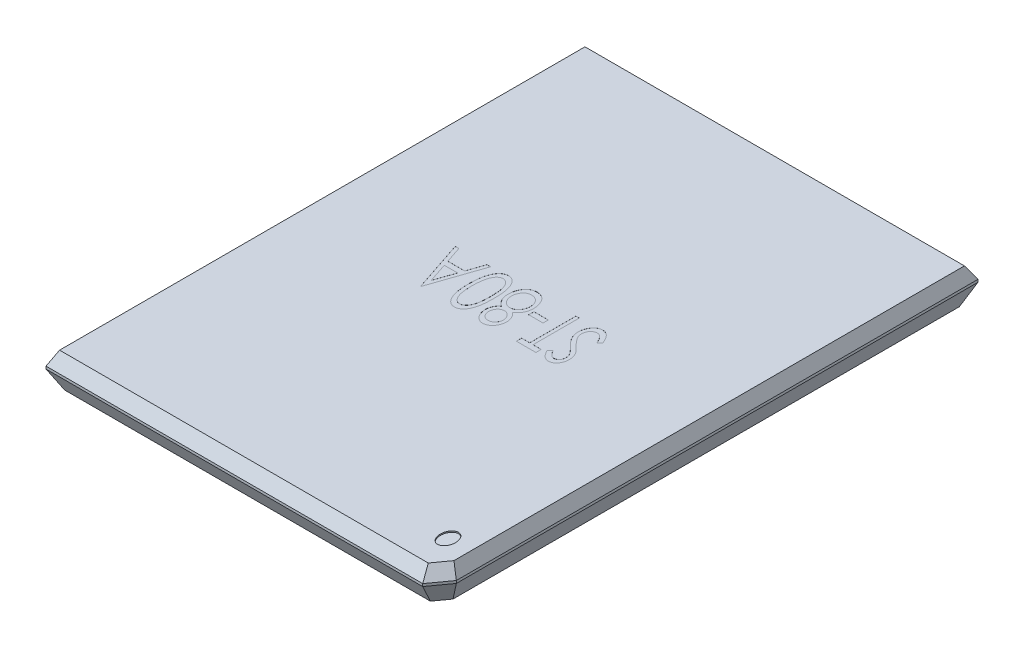
from build123d import *
from OCP.BRepFilletAPI import BRepFilletAPI_MakeChamfer

# Parameters (mm, degrees)
EXTRUDE1_DEPTH     = 1.397
CHAMFER1_SIZE      = 0.508
CHAMFER1_SIZE2     = 0.174918428
SKETCH2_R          = 0.231604239
CUT_EXTRUDE1_DEPTH = 0.0508
SKETCH3_W          = 0.439615384
SKETCH3_H          = 0.11723077
CUT_EXTRUDE2_DEPTH = 0.00254
CHAMFER2_SIZE      = 0.7874
CHAMFER2_SIZE2     = 0.240732339
SCALE1_SCALE_X     = 1.3
SCALE1_SCALE_Y     = 1
SCALE1_SCALE_Z     = 1.8


with BuildPart() as part:
    # Sketch1 → Extrude1 (new body)
    with BuildSketch(Plane(origin=(0, 0, 0), x_dir=(1, 0, 0), z_dir=(0, 1, 0))):
        Polygon((6.00075, -5.567758795), (5.567758795, -6.00075), (5.20854855, -6.00075), (-6.00075, -6.00075), (-6.00075, 6.00075), (6.00075, 6.00075), (6.00075, -5.20854855), align=None)
    extrude(amount=EXTRUDE1_DEPTH)

    # Chamfer1: one chamfer whose edges measure the first distance from different faces: ONE call of the kernel's chamfer builder (chamfer() names one face for all edges)
    chamfer1_edges_1 = [part.edges().sort_by_distance(p)[0] for p in [
        (-6.00075, 1.397, 0),
    ]]
    chamfer1_side_1 = [part.faces().sort_by_distance(p)[0] for p in [
        (-6.00075, 0.6985, 0),
    ]]
    chamfer1_edges_2 = [part.edges().sort_by_distance(p)[0] for p in [
        (-0.216495602, 1.397, 6.00075),
    ]]
    chamfer1_side_2 = [part.faces().sort_by_distance(p)[0] for p in [
        (-0.216495602, 0.6985, 6.00075),
    ]]
    chamfer1_edges_3 = [part.edges().sort_by_distance(p)[0] for p in [
        (5.784254398, 1.397, 5.784254398),
    ]]
    chamfer1_side_3 = [part.faces().sort_by_distance(p)[0] for p in [
        (5.784254398, 0.6985, 5.784254398),
    ]]
    chamfer1_edges_4 = [part.edges().sort_by_distance(p)[0] for p in [
        (6.00075, 1.397, -0.216495602),
    ]]
    chamfer1_side_4 = [part.faces().sort_by_distance(p)[0] for p in [
        (6.00075, 0.6985, -0.216495602),
    ]]
    chamfer1_edges_5 = [part.edges().sort_by_distance(p)[0] for p in [
        (0, 1.397, -6.00075),
    ]]
    chamfer1_side_5 = [part.faces().sort_by_distance(p)[0] for p in [
        (0, 0.6985, -6.00075),
    ]]
    chamfer1 = BRepFilletAPI_MakeChamfer(part.part.solid().wrapped)
    for e in chamfer1_edges_1:
        chamfer1.Add(CHAMFER1_SIZE, CHAMFER1_SIZE2, e.wrapped, chamfer1_side_1[0].wrapped)  # the first distance lies on this face
    for e in chamfer1_edges_2:
        chamfer1.Add(CHAMFER1_SIZE, CHAMFER1_SIZE2, e.wrapped, chamfer1_side_2[0].wrapped)  # the first distance lies on this face
    for e in chamfer1_edges_3:
        chamfer1.Add(CHAMFER1_SIZE, CHAMFER1_SIZE2, e.wrapped, chamfer1_side_3[0].wrapped)  # the first distance lies on this face
    for e in chamfer1_edges_4:
        chamfer1.Add(CHAMFER1_SIZE, CHAMFER1_SIZE2, e.wrapped, chamfer1_side_4[0].wrapped)  # the first distance lies on this face
    for e in chamfer1_edges_5:
        chamfer1.Add(CHAMFER1_SIZE, CHAMFER1_SIZE2, e.wrapped, chamfer1_side_5[0].wrapped)  # the first distance lies on this face
    add(Compound.cast(chamfer1.Shape()), mode=Mode.REPLACE)

    # Sketch2 → Cut-Extrude1 (cut)
    with BuildSketch(Plane(origin=(0, 1.397, 0), x_dir=(-1, 0, 0), z_dir=(0, 1, 0))):
        with Locations(Location((-5.141267289, 5.13311948, 0), (0, 0, 90))):
            Circle(SKETCH2_R)
    extrude(amount=-CUT_EXTRUDE1_DEPTH, mode=Mode.SUBTRACT)

    # Sketch3 → Cut-Extrude2 (cut)
    # profile 1 of 6: a face of its own
    with BuildSketch(Plane(origin=(0, 1.397, 0), x_dir=(-1, 0, 0), z_dir=(0, 1, 0))):
        with BuildLine():
            Line((-2.325409022, -0.3335564), (-2.228785223, -0.275627915))
            add(Edge.make_bspline(
                [(-2.228785223, -0.275627915), (-2.219798553, -0.290671227), (-2.20258044, -0.319493632), (-2.173858039, -0.3584399), (-2.144096634, -0.391541885), (-2.113075832, -0.418607017), (-2.080984981, -0.439915439), (-2.047614589, -0.455003768), (-2.013077109, -0.464414242), (-1.989572516, -0.46555727), (-1.977838108, -0.466127915)],
                knots=[0, 0, 0, 0, 1.272034388, 2.437168799, 3.508375237, 4.49857839, 5.41946034, 6.295179144, 7.148887113, 8, 8, 8, 8], degree=3))
            add(Edge.make_bspline(
                [(-1.977838108, -0.466127915), (-1.967816656, -0.465848803), (-1.947949104, -0.465295464), (-1.918700635, -0.459978619), (-1.890294863, -0.451810372), (-1.863317242, -0.440112279), (-1.838140017, -0.425959168), (-1.816061602, -0.408864402), (-1.796974772, -0.38972529), (-1.781361681, -0.368373183), (-1.769383029, -0.345409611), (-1.760176305, -0.321839008), (-1.755067071, -0.297291101), (-1.754297423, -0.28076317), (-1.753909022, -0.272422386)],
                knots=[0, 0, 0, 0, 1.095163259, 2.171163733, 3.241058638, 4.321873601, 5.38011039, 6.391990106, 7.366004449, 8.327778327, 9.272591725, 10.192022065, 11.087607919, 12, 12, 12, 12], degree=3))
            add(Edge.make_bspline(
                [(-1.753909022, -0.272422386), (-1.754390489, -0.262905817), (-1.755369243, -0.243560023), (-1.763641781, -0.215017793), (-1.776655406, -0.186771791), (-1.788661035, -0.169299806), (-1.794893998, -0.160228876)],
                knots=[0, 0, 0, 0, 0.938893495, 1.908633276, 2.914225137, 4, 4, 4, 4], degree=3))
            add(Edge.make_bspline(
                [(-1.794893998, -0.160228876), (-1.800011572, -0.153682156), (-1.810755281, -0.139938137), (-1.829225348, -0.119479993), (-1.850898625, -0.098377464), (-1.875033415, -0.075824749), (-1.902508878, -0.052870762), (-1.932464463, -0.028420922), (-1.965664975, -0.003405036), (-1.988949353, 0.013371777), (-2.000963709, 0.022028335)],
                knots=[0, 0, 0, 0, 0.722233717, 1.516239348, 2.393582979, 3.351407094, 4.387010283, 5.505090956, 6.712668013, 8, 8, 8, 8], degree=3))
            add(Edge.make_bspline(
                [(-2.000963709, 0.022028335), (-2.012989374, 0.030593843), (-2.03598153, 0.046970441), (-2.06813529, 0.071275285), (-2.096888096, 0.093496469), (-2.122112152, 0.113843179), (-2.143796363, 0.132318176), (-2.162111603, 0.148744045), (-2.176591309, 0.16356502), (-2.184643117, 0.173179721), (-2.18825818, 0.177496484)],
                knots=[0, 0, 0, 0, 1.452282411, 2.77665338, 3.964542531, 5.026858415, 5.96415736, 6.766646006, 7.446254459, 8, 8, 8, 8], degree=3))
            add(Edge.make_bspline(
                [(-2.18825818, 0.177496484), (-2.193311071, 0.184224194), (-2.20324826, 0.197455139), (-2.21636533, 0.218135228), (-2.227514205, 0.239304655), (-2.236254018, 0.261020304), (-2.243613703, 0.282977311), (-2.24856385, 0.305462161), (-2.251663469, 0.328373961), (-2.251980892, 0.343792541), (-2.252139791, 0.351510908)],
                knots=[0, 0, 0, 0, 1.068054152, 2.10047183, 3.106115577, 4.101338837, 5.06977816, 6.043150881, 7.020423561, 8, 8, 8, 8], degree=3))
            add(Edge.make_bspline(
                [(-2.252139791, 0.351510908), (-2.251713547, 0.363603774), (-2.25087017, 0.38753103), (-2.243737681, 0.422484241), (-2.232479819, 0.455855406), (-2.216708088, 0.48731414), (-2.196376615, 0.516041316), (-2.172848459, 0.542367378), (-2.144824879, 0.564498661), (-2.114077322, 0.583835627), (-2.080422056, 0.598970882), (-2.045155312, 0.610388139), (-2.00822104, 0.616857277), (-1.983204644, 0.617785643), (-1.970511185, 0.618256701)],
                knots=[0, 0, 0, 0, 1.005424448, 1.989358655, 2.955360095, 3.929531133, 4.905563448, 5.876582895, 6.856512386, 7.866279853, 8.892233794, 9.918561126, 10.94386622, 12, 12, 12, 12], degree=3))
            add(Edge.make_bspline(
                [(-1.970511185, 0.618256701), (-1.95704204, 0.617792136), (-1.93025621, 0.616868265), (-1.890855624, 0.608835414), (-1.852920852, 0.595543738), (-1.822404952, 0.580459842), (-1.798521882, 0.565394639), (-1.780308101, 0.551672165), (-1.761851116, 0.535874237), (-1.743002048, 0.517958775), (-1.724080284, 0.497761393), (-1.704804911, 0.475420416), (-1.685130854, 0.451072375), (-1.672474298, 0.433690774), (-1.665985945, 0.424780138)],
                knots=[0, 0, 0, 0, 1.286793592, 2.559021753, 3.825965368, 5.121522368, 5.803751409, 6.523245864, 7.299691795, 8.125521123, 9.008227632, 9.944561021, 10.946284179, 12, 12, 12, 12], degree=3))
            Line((-1.665985945, 0.424780138), (-1.758717315, 0.35448747))
            add(Edge.make_bspline(
                [(-1.758717315, 0.35448747), (-1.764316687, 0.361701005), (-1.775099767, 0.375592587), (-1.791470625, 0.395046877), (-1.806900684, 0.412817745), (-1.822102714, 0.428253185), (-1.836273835, 0.442198482), (-1.850028057, 0.454137854), (-1.863167447, 0.464188284), (-1.879730141, 0.474914052), (-1.900538527, 0.485546076), (-1.926659191, 0.494542818), (-1.95395608, 0.499949228), (-1.972547672, 0.500664056), (-1.981959502, 0.501025932)],
                knots=[0, 0, 0, 0, 1.181633172, 2.275549214, 3.290209073, 4.226197932, 5.078386478, 5.862611352, 6.581680152, 7.217281963, 8.414376989, 9.595101626, 10.782541182, 12, 12, 12, 12], degree=3))
            add(Edge.make_bspline(
                [(-1.981959502, 0.501025932), (-1.99376719, 0.500630225), (-2.016537202, 0.499867142), (-2.048864585, 0.491533044), (-2.077960115, 0.478410797), (-2.102959996, 0.460019934), (-2.123774671, 0.438230764), (-2.138831397, 0.413156983), (-2.147893808, 0.385469473), (-2.14899967, 0.366155498), (-2.149562868, 0.356319201)],
                knots=[0, 0, 0, 0, 1.14458467, 2.207223713, 3.21896685, 4.227309161, 5.202851033, 6.127160689, 7.046193047, 8, 8, 8, 8], degree=3))
            add(Edge.make_bspline(
                [(-2.149562868, 0.356319201), (-2.149434484, 0.350195504), (-2.149177506, 0.337938096), (-2.145593451, 0.319829246), (-2.140989013, 0.301766143), (-2.133692547, 0.283829996), (-2.123619353, 0.265707124), (-2.110391519, 0.247085454), (-2.093732029, 0.227800853), (-2.080970594, 0.215258102), (-2.07423294, 0.208635908)],
                knots=[0, 0, 0, 0, 0.858281714, 1.717966888, 2.583508476, 3.4729293, 4.427298488, 5.488583878, 6.674047936, 8, 8, 8, 8], degree=3))
            add(Edge.make_bspline(
                [(-2.07423294, 0.208635908), (-2.071730955, 0.20640313), (-2.06578681, 0.201098563), (-2.054919843, 0.192414283), (-2.040569381, 0.181701835), (-2.023110154, 0.168447177), (-2.002220241, 0.153071717), (-1.977897346, 0.135772049), (-1.950412594, 0.115986569), (-1.930909123, 0.102153806), (-1.920596522, 0.094839633)],
                knots=[0, 0, 0, 0, 0.420754252, 0.999615792, 1.744751191, 2.668019286, 3.750313428, 4.999500688, 6.413464383, 8, 8, 8, 8], degree=3))
            add(Edge.make_bspline(
                [(-1.920596522, 0.094839633), (-1.908191408, 0.085812755), (-1.884170624, 0.068333457), (-1.849992448, 0.042071993), (-1.819002842, 0.016387879), (-1.791093001, -0.008554865), (-1.7659872, -0.03256704), (-1.743963967, -0.05593753), (-1.7247989, -0.078498904), (-1.704166373, -0.107424177), (-1.683083633, -0.142948971), (-1.664978021, -0.186473835), (-1.653561624, -0.230167891), (-1.652068697, -0.259535426), (-1.651332098, -0.27402515)],
                knots=[0, 0, 0, 0, 1.163667725, 2.253281268, 3.268753668, 4.215851969, 5.092017293, 5.902905408, 6.650798638, 7.335211899, 8.59617414, 9.77448103, 10.901945474, 12, 12, 12, 12], degree=3))
            add(Edge.make_bspline(
                [(-1.651332098, -0.27402515), (-1.651546701, -0.284272428), (-1.651971739, -0.304567987), (-1.656857546, -0.334369288), (-1.664015882, -0.363313598), (-1.674804899, -0.391043141), (-1.68797329, -0.418065217), (-1.704682725, -0.443670997), (-1.72405092, -0.468427201), (-1.746268804, -0.491673695), (-1.770580709, -0.513013896), (-1.796276555, -0.531997186), (-1.823398401, -0.547825556), (-1.851799116, -0.560741731), (-1.881485222, -0.570843734), (-1.912446735, -0.578163137), (-1.944734693, -0.582655359), (-1.96668045, -0.583121625), (-1.977838108, -0.583358684)],
                knots=[0, 0, 0, 0, 0.983748083, 1.948392443, 2.894712957, 3.844097841, 4.80183111, 5.778335162, 6.776009319, 7.81870978, 8.863265674, 9.881300176, 10.883814829, 11.87499822, 12.874611388, 13.892143829, 14.928324115, 16, 16, 16, 16], degree=3))
            add(Edge.make_bspline(
                [(-1.977838108, -0.583358684), (-1.986471136, -0.583191747), (-2.003628467, -0.582859974), (-2.029006164, -0.579926945), (-2.053871178, -0.575777168), (-2.077911499, -0.569188893), (-2.10143686, -0.561195412), (-2.124344942, -0.551353093), (-2.146646849, -0.539558247), (-2.168467563, -0.526072472), (-2.189751586, -0.510378186), (-2.210299287, -0.492098841), (-2.230784846, -0.47173858), (-2.250603616, -0.448744502), (-2.270156474, -0.423488094), (-2.289057909, -0.395733055), (-2.307699167, -0.365630565), (-2.319395476, -0.344447481), (-2.325409022, -0.3335564)],
                knots=[0, 0, 0, 0, 0.915332311, 1.819136955, 2.706846663, 3.586547465, 4.459518054, 5.340707479, 6.227863349, 7.133153174, 8.059268498, 9.028702269, 10.047606654, 11.120612155, 12.245963614, 13.433783089, 14.680604001, 16, 16, 16, 16], degree=3))
        make_face()
    # profile 2 of 6: a face of its own
    with BuildSketch(Plane(origin=(0, 1.397, 0), x_dir=(-1, 0, 0), z_dir=(0, 1, 0))):
        Polygon((-1.548755175, 0.471718239), (-1.548755175, 0.588949008), (-0.947947483, 0.588949008), (-0.947947483, 0.471718239), (-1.197062868, 0.471718239), (-1.197062868, -0.554050992), (-1.299639791, -0.554050992), (-1.299639791, 0.471718239), align=None)
    # profile 3 of 6: a face of its own
    with BuildSketch(Plane(origin=(0, 1.397, 0), x_dir=(-1, 0, 0), z_dir=(0, 1, 0))):
        with Locations((-0.65487056, -0.114435607)):
            Rectangle(SKETCH3_W, SKETCH3_H)
    # profile 4 of 6: a face of its own
    with BuildSketch(Plane(origin=(0, 1.397, 0), x_dir=(-1, 0, 0), z_dir=(0, 1, 0))):
        with BuildLine():
            add(Edge.make_bspline(
                [(0.208561531, 0.082704417), (0.217917328, 0.077826108), (0.236164257, 0.068311775), (0.262151899, 0.052992039), (0.285901807, 0.036846032), (0.308072925, 0.020636379), (0.328275728, 0.003742299), (0.346284317, -0.013903386), (0.362543531, -0.031860224), (0.376725478, -0.050432289), (0.389199474, -0.06957024), (0.399980294, -0.089324309), (0.409195226, -0.109651203), (0.416498323, -0.130772808), (0.422514354, -0.152378859), (0.426653844, -0.174748343), (0.428880055, -0.197733857), (0.429300945, -0.213268306), (0.429514055, -0.221133924)],
                knots=[0, 0, 0, 0, 1.272397273, 2.481599622, 3.635517121, 4.734568067, 5.792894095, 6.808321871, 7.773003508, 8.711915296, 9.623354172, 10.525449501, 11.423591555, 12.311487226, 13.218079475, 14.126165749, 15.051214107, 16, 16, 16, 16], degree=3))
            add(Edge.make_bspline(
                [(0.429514055, -0.221133924), (0.429262131, -0.232138641), (0.42876348, -0.253921104), (0.424420085, -0.286070792), (0.417917075, -0.317294868), (0.408420537, -0.347586488), (0.396104421, -0.376778503), (0.380926414, -0.404895902), (0.363745098, -0.432399522), (0.349946724, -0.449322258), (0.342964777, -0.457885126)],
                knots=[0, 0, 0, 0, 1.025265484, 2.029385089, 3.018602448, 3.995076438, 4.983346944, 5.966715145, 6.97116228, 8, 8, 8, 8], degree=3))
            add(Edge.make_bspline(
                [(0.342964777, -0.457885126), (0.333874179, -0.467876179), (0.31580532, -0.487734822), (0.284851924, -0.5135179), (0.250881349, -0.535185717), (0.214025042, -0.552844053), (0.174381523, -0.566588092), (0.13195924, -0.576464434), (0.08667549, -0.582121444), (0.055551446, -0.582939176), (0.039584368, -0.583358684)],
                knots=[0, 0, 0, 0, 0.954267603, 1.896743057, 2.838368354, 3.796610408, 4.779680527, 5.799409237, 6.871065594, 8, 8, 8, 8], degree=3))
            add(Edge.make_bspline(
                [(0.039584368, -0.583358684), (0.024231138, -0.582982317), (-0.005644687, -0.582249947), (-0.049130245, -0.577287879), (-0.089665293, -0.568591979), (-0.12748552, -0.556690211), (-0.162362922, -0.541207385), (-0.194198118, -0.521936925), (-0.223450418, -0.499654485), (-0.24923208, -0.473720116), (-0.272120964, -0.445942645), (-0.292227331, -0.417285477), (-0.308939322, -0.387745994), (-0.323088714, -0.357764658), (-0.333920442, -0.326921242), (-0.34142251, -0.295374438), (-0.346186963, -0.263179347), (-0.346820882, -0.24145201), (-0.347139791, -0.230521544)],
                knots=[0, 0, 0, 0, 1.256902934, 2.445805442, 3.576955095, 4.645999104, 5.686449165, 6.692658513, 7.68621702, 8.689161843, 9.678783111, 10.630372946, 11.551080876, 12.453998257, 13.34127905, 14.221779781, 15.105423033, 16, 16, 16, 16], degree=3))
            add(Edge.make_bspline(
                [(-0.347139791, -0.230521544), (-0.346951071, -0.222501214), (-0.346578095, -0.20665021), (-0.343996598, -0.183231992), (-0.339846377, -0.160438569), (-0.334209932, -0.138185749), (-0.326571091, -0.116635538), (-0.317348017, -0.095685826), (-0.306593382, -0.075312962), (-0.294157162, -0.055405533), (-0.279689387, -0.036242481), (-0.263307372, -0.017498589), (-0.244683699, 0.000535295), (-0.224025555, 0.018079504), (-0.201569021, 0.035445258), (-0.176730805, 0.051694057), (-0.150169357, 0.067976244), (-0.131291763, 0.077710792), (-0.12160794, 0.082704417)],
                knots=[0, 0, 0, 0, 0.941657376, 1.861047343, 2.762797495, 3.66048619, 4.553285746, 5.444104102, 6.34607688, 7.256116206, 8.197091036, 9.162375105, 10.176350973, 11.237807142, 12.343728897, 13.50695164, 14.721116704, 16, 16, 16, 16], degree=3))
            add(Edge.make_bspline(
                [(-0.12160794, 0.082704417), (-0.134863923, 0.089933), (-0.160531217, 0.10392956), (-0.194517323, 0.129646017), (-0.223709747, 0.157498581), (-0.247306073, 0.188075396), (-0.265878918, 0.220421276), (-0.278621279, 0.254333842), (-0.287241617, 0.289184275), (-0.288095544, 0.312993356), (-0.288524406, 0.324950811)],
                knots=[0, 0, 0, 0, 1.166880483, 2.259407225, 3.286803203, 4.280235371, 5.237608625, 6.161067461, 7.076446754, 8, 8, 8, 8], degree=3))
            add(Edge.make_bspline(
                [(-0.288524406, 0.324950811), (-0.287990323, 0.337131128), (-0.286916724, 0.36161569), (-0.278235371, 0.398063061), (-0.264088275, 0.433860699), (-0.244846361, 0.468835099), (-0.220880193, 0.501802555), (-0.192126706, 0.531370641), (-0.159272544, 0.557271505), (-0.122481704, 0.579013381), (-0.082889413, 0.596708216), (-0.041115792, 0.608914941), (0.002111323, 0.616895078), (0.031534664, 0.617798588), (0.046453358, 0.618256701)],
                knots=[0, 0, 0, 0, 0.888701115, 1.786444228, 2.72001202, 3.692817113, 4.693886446, 5.687152267, 6.695133018, 7.739871481, 8.800368666, 9.853104506, 10.91144658, 12, 12, 12, 12], degree=3))
            add(Edge.make_bspline(
                [(0.046453358, 0.618256701), (0.060987033, 0.617784366), (0.089645783, 0.616852977), (0.131771743, 0.609084862), (0.172078781, 0.596110336), (0.210427901, 0.578509043), (0.246132565, 0.556828965), (0.277680119, 0.530572337), (0.305547302, 0.501134682), (0.328598148, 0.468177223), (0.347592486, 0.433337213), (0.360818923, 0.396884487), (0.369294097, 0.359606666), (0.370363084, 0.33438294), (0.370898671, 0.321745283)],
                knots=[0, 0, 0, 0, 1.072916533, 2.115669174, 3.151510826, 4.193348718, 5.225979165, 6.227137561, 7.216255879, 8.211077061, 9.189680878, 10.138522389, 11.067357538, 12, 12, 12, 12], degree=3))
            add(Edge.make_bspline(
                [(0.370898671, 0.321745283), (0.370430184, 0.309343189), (0.369510103, 0.284986183), (0.36177038, 0.249479208), (0.348735832, 0.216227039), (0.330939596, 0.184852358), (0.307744701, 0.155924171), (0.279460763, 0.129074621), (0.24631328, 0.104083146), (0.221408654, 0.089979713), (0.208561531, 0.082704417)],
                knots=[0, 0, 0, 0, 0.975232327, 1.915300861, 2.843280834, 3.77672583, 4.742871857, 5.749627742, 6.839139064, 8, 8, 8, 8], degree=3))
        make_face()
        with BuildLine():
            add(Edge.make_bspline(
                [(0.0407292, 0.501025932), (0.032711608, 0.50081319), (0.017025693, 0.500396974), (-0.005974299, 0.498222453), (-0.027845561, 0.493992302), (-0.048816606, 0.488362632), (-0.068599916, 0.48075744), (-0.087464169, 0.471811013), (-0.105088311, 0.460934204), (-0.121685097, 0.448733104), (-0.136625992, 0.435313335), (-0.149886279, 0.421331597), (-0.160900917, 0.406513291), (-0.170254285, 0.391227018), (-0.177040935, 0.37501909), (-0.182123792, 0.358386423), (-0.185559778, 0.341118833), (-0.185817244, 0.329317681), (-0.185947483, 0.323348047)],
                knots=[0, 0, 0, 0, 1.203892937, 2.355340988, 3.463153438, 4.544400666, 5.610487187, 6.640501085, 7.674077295, 8.714426146, 9.728707835, 10.68524104, 11.601827946, 12.495867327, 13.368432065, 14.231010473, 15.105153427, 16, 16, 16, 16], degree=3))
            add(Edge.make_bspline(
                [(-0.185947483, 0.323348047), (-0.185723009, 0.317378155), (-0.185279415, 0.30558079), (-0.18184874, 0.288159555), (-0.176735659, 0.271040146), (-0.168685457, 0.254629634), (-0.159029929, 0.238358749), (-0.147112856, 0.222634143), (-0.132910582, 0.207401093), (-0.116899621, 0.192789163), (-0.099456939, 0.179106224), (-0.080978207, 0.167227783), (-0.061695342, 0.157288872), (-0.041806467, 0.149017012), (-0.021108876, 0.142586841), (0.000270603, 0.13802508), (0.022335566, 0.135189788), (0.037286196, 0.134851126), (0.044850594, 0.134679778)],
                knots=[0, 0, 0, 0, 0.873023192, 1.725219244, 2.590779336, 3.480155217, 4.391973325, 5.357036234, 6.360879153, 7.436073238, 8.526419356, 9.601555421, 10.645666583, 11.697338044, 12.750135903, 13.812665442, 14.89329948, 16, 16, 16, 16], degree=3))
            add(Edge.make_bspline(
                [(0.044850594, 0.134679778), (0.054566128, 0.134964831), (0.073901236, 0.135532123), (0.102404172, 0.140806635), (0.130117887, 0.149103481), (0.156746163, 0.160455093), (0.181599746, 0.174702706), (0.203754374, 0.191760517), (0.223021074, 0.211234656), (0.239199622, 0.232821954), (0.25174318, 0.255796772), (0.261508256, 0.278852811), (0.26721059, 0.302236054), (0.267954379, 0.317900694), (0.268321748, 0.32563771)],
                knots=[0, 0, 0, 0, 1.076279235, 2.141928126, 3.20205304, 4.278698113, 5.344010996, 6.36967002, 7.368914609, 8.37248503, 9.349703398, 10.264243087, 11.142681841, 12, 12, 12, 12], degree=3))
            add(Edge.make_bspline(
                [(0.268321748, 0.32563771), (0.268148045, 0.331067952), (0.26780327, 0.341846203), (0.264962081, 0.35776276), (0.260267344, 0.373317222), (0.253911259, 0.388638082), (0.245547831, 0.403510384), (0.235631755, 0.418167918), (0.223586331, 0.432280952), (0.210067438, 0.446178378), (0.194736409, 0.459040075), (0.177622789, 0.470350782), (0.158814315, 0.479956017), (0.138310545, 0.487757402), (0.116186988, 0.493616861), (0.092545544, 0.498004788), (0.067189086, 0.50047795), (0.049740456, 0.500839309), (0.0407292, 0.501025932)],
                knots=[0, 0, 0, 0, 0.814439003, 1.616544685, 2.417341072, 3.248991801, 4.09997495, 4.973547432, 5.9003056, 6.880240646, 7.880314356, 8.896779544, 9.951930927, 11.043077905, 12.18215768, 13.381699519, 14.647792085, 16, 16, 16, 16], degree=3))
        make_face(mode=Mode.SUBTRACT)
        with BuildLine():
            add(Edge.make_bspline(
                [(0.047369224, 0.017449008), (0.037204431, 0.017268205), (0.017263589, 0.016913513), (-0.011950488, 0.012965427), (-0.039987679, 0.007469428), (-0.066753452, -0.000868214), (-0.092236505, -0.011709239), (-0.116574791, -0.024750719), (-0.139582117, -0.040166668), (-0.160940778, -0.057761231), (-0.180444711, -0.07672179), (-0.197556499, -0.096793567), (-0.212088118, -0.117603526), (-0.223790234, -0.13941596), (-0.233395265, -0.161768994), (-0.239702626, -0.185219303), (-0.243746139, -0.209316066), (-0.244289107, -0.225696921), (-0.244562868, -0.23395604)],
                knots=[0, 0, 0, 0, 1.140299081, 2.23698856, 3.303958914, 4.344563908, 5.37730929, 6.408454204, 7.439741482, 8.480804886, 9.510774543, 10.48932336, 11.43758569, 12.353841022, 13.263987381, 14.161954604, 15.073269652, 16, 16, 16, 16], degree=3))
            add(Edge.make_bspline(
                [(-0.244562868, -0.23395604), (-0.244117666, -0.244220475), (-0.243234397, -0.264584877), (-0.236227272, -0.294682702), (-0.22498161, -0.32381975), (-0.209297947, -0.351758573), (-0.189877537, -0.377867994), (-0.165996521, -0.400626357), (-0.139139014, -0.420848142), (-0.10839628, -0.437203014), (-0.074815441, -0.450264191), (-0.038405428, -0.459263181), (0.000311221, -0.465220317), (0.027044225, -0.465820614), (0.0407292, -0.466127915)],
                knots=[0, 0, 0, 0, 0.898778495, 1.783155532, 2.693654817, 3.627872908, 4.583023416, 5.533784346, 6.509005473, 7.520592997, 8.575161974, 9.658835044, 10.801527049, 12, 12, 12, 12], degree=3))
            add(Edge.make_bspline(
                [(0.0407292, -0.466127915), (0.051424534, -0.465922564), (0.072262475, -0.465522474), (0.102661687, -0.461990835), (0.131349206, -0.456390257), (0.158269403, -0.448244408), (0.183723634, -0.438300316), (0.207280327, -0.425507833), (0.229545486, -0.410958317), (0.249421969, -0.393696354), (0.267524871, -0.375251764), (0.283309144, -0.355726044), (0.297011281, -0.335649859), (0.30776559, -0.314569515), (0.316362993, -0.292889446), (0.322542885, -0.270409735), (0.326356003, -0.247061434), (0.32674165, -0.231223023), (0.326937132, -0.223194621)],
                knots=[0, 0, 0, 0, 1.224942928, 2.386581632, 3.501229538, 4.569074225, 5.605009692, 6.626002462, 7.634866581, 8.645888296, 9.63523824, 10.59253846, 11.518950513, 12.414518923, 13.29783783, 14.186679152, 15.080837789, 16, 16, 16, 16], degree=3))
            add(Edge.make_bspline(
                [(0.326937132, -0.223194621), (0.326641308, -0.215396964), (0.326057994, -0.200021346), (0.322355755, -0.177237592), (0.315851798, -0.155225759), (0.306927451, -0.133721028), (0.295046468, -0.113159127), (0.281054558, -0.093004389), (0.264172736, -0.073816213), (0.245096851, -0.055445559), (0.224307653, -0.038458706), (0.202209497, -0.023431705), (0.178972483, -0.010776371), (0.154645781, -0.000483984), (0.12928341, 0.007610896), (0.102904022, 0.013265805), (0.075476732, 0.016825304), (0.056844242, 0.017238758), (0.047369224, 0.017449008)],
                knots=[0, 0, 0, 0, 0.917430815, 1.809013306, 2.70690318, 3.612392954, 4.541220862, 5.495268465, 6.494511384, 7.542276156, 8.608045339, 9.649016899, 10.681629292, 11.715607085, 12.752076957, 13.808767841, 14.885711793, 16, 16, 16, 16], degree=3))
        make_face(mode=Mode.SUBTRACT)
    # profile 5 of 6: a face of its own
    with BuildSketch(Plane(origin=(0, 1.397, 0), x_dir=(-1, 0, 0), z_dir=(0, 1, 0))):
        with BuildLine():
            add(Edge.make_bspline(
                [(0.532090978, 0.016991076), (0.5321981, 0.03531088), (0.532406185, 0.070897363), (0.53472106, 0.122751891), (0.538566551, 0.171398065), (0.543836556, 0.216838215), (0.550249759, 0.259084071), (0.558810988, 0.298022736), (0.568546997, 0.333834431), (0.579830839, 0.366635934), (0.592563137, 0.396869167), (0.606420954, 0.425093168), (0.621954257, 0.451265233), (0.638275289, 0.475803089), (0.656044717, 0.498305067), (0.674756865, 0.519088942), (0.695142066, 0.537674367), (0.716507351, 0.554605888), (0.739046156, 0.569448387), (0.762116033, 0.582521936), (0.785875772, 0.593690635), (0.810390242, 0.602472283), (0.835439106, 0.609725711), (0.861109928, 0.614685988), (0.887445094, 0.617807001), (0.905220845, 0.618105379), (0.91423581, 0.618256701)],
                knots=[0, 0, 0, 0, 1.646270934, 3.197905019, 4.663502075, 6.030701355, 7.308322542, 8.50163776, 9.611534131, 10.641858119, 11.616356847, 12.558055219, 13.465016945, 14.349605745, 15.204443733, 16.039544428, 16.859896111, 17.680448484, 18.487036065, 19.28249412, 20.06191084, 20.843045899, 21.620316918, 22.403196591, 23.190181807, 24, 24, 24, 24], degree=3))
            add(Edge.make_bspline(
                [(0.91423581, 0.618256701), (0.923326082, 0.618097394), (0.941403773, 0.617780584), (0.968130501, 0.614735651), (0.994239783, 0.609683224), (1.019620307, 0.60252446), (1.044480552, 0.593643129), (1.06862607, 0.58251125), (1.09220684, 0.569553266), (1.114848131, 0.55432724), (1.136798504, 0.537351313), (1.157518796, 0.518161105), (1.177010893, 0.496950382), (1.195519429, 0.473946082), (1.212519299, 0.448706982), (1.228708566, 0.421672057), (1.243199205, 0.39236852), (1.257155129, 0.361285298), (1.269201365, 0.327562338), (1.28006517, 0.291389732), (1.288843073, 0.252340219), (1.29615477, 0.210618679), (1.301819117, 0.166071893), (1.305944577, 0.11879535), (1.308123816, 0.068757948), (1.308534219, 0.034547028), (1.308744825, 0.016991076)],
                knots=[0, 0, 0, 0, 0.810914788, 1.612654377, 2.396697861, 3.181598691, 3.963628158, 4.749916497, 5.551656086, 6.361998678, 7.18212741, 8.025565596, 8.878627764, 9.750805457, 10.657531673, 11.591944965, 12.560506719, 13.57287815, 14.630710178, 15.753379473, 16.941251878, 18.199788006, 19.531962791, 20.947069417, 22.433333509, 24, 24, 24, 24], degree=3))
            add(Edge.make_bspline(
                [(1.308744825, 0.016991076), (1.308532036, -0.000488303), (1.308117425, -0.034546161), (1.305969008, -0.084358419), (1.301737089, -0.131384066), (1.29644337, -0.175735883), (1.289111527, -0.217229271), (1.280096468, -0.256007815), (1.270086948, -0.292238979), (1.257731186, -0.325625947), (1.244207631, -0.356634467), (1.229493891, -0.385590624), (1.213730345, -0.412750359), (1.196556363, -0.437896277), (1.17825092, -0.461206507), (1.158422225, -0.482269587), (1.137629231, -0.501593038), (1.115614262, -0.518787556), (1.092619861, -0.533837536), (1.069120083, -0.547296802), (1.044697967, -0.558149651), (1.019906965, -0.56746838), (0.994392473, -0.574587785), (0.968186295, -0.579510475), (0.94142173, -0.582962939), (0.923329161, -0.583226312), (0.91423581, -0.583358684)],
                knots=[0, 0, 0, 0, 1.561518951, 3.042555995, 4.452378317, 5.7783523, 7.031515105, 8.214008947, 9.334062868, 10.386615937, 11.391082383, 12.354592575, 13.286541444, 14.194233754, 15.072674879, 15.931287219, 16.775624067, 17.606195743, 18.42308326, 19.229000347, 20.022332153, 20.807536673, 21.593273796, 22.3848459, 23.188221202, 24, 24, 24, 24], degree=3))
            add(Edge.make_bspline(
                [(0.91423581, -0.583358684), (0.905221095, -0.583206385), (0.887445837, -0.582906083), (0.861107059, -0.57979917), (0.83554225, -0.574804096), (0.810625257, -0.567810045), (0.786228243, -0.559249028), (0.762683656, -0.548095411), (0.739729707, -0.535250028), (0.717427636, -0.520621123), (0.696196521, -0.503860928), (0.675916891, -0.485323333), (0.657098206, -0.464545744), (0.639582843, -0.44185624), (0.622936162, -0.417463561), (0.607623433, -0.391034667), (0.593459751, -0.362674351), (0.58051332, -0.332199388), (0.56903477, -0.299165078), (0.558895476, -0.263193504), (0.550889852, -0.223967169), (0.544037419, -0.181801126), (0.538510399, -0.136514182), (0.534737086, -0.088081753), (0.532404937, -0.036534017), (0.532197541, -0.001176202), (0.532090978, 0.016991076)],
                knots=[0, 0, 0, 0, 0.810891512, 1.598919785, 2.382837074, 3.152667961, 3.926044502, 4.706494248, 5.493654104, 6.291793342, 7.103789334, 7.925228297, 8.761435821, 9.622817696, 10.50288917, 11.416980706, 12.369136599, 13.353924996, 14.394355917, 15.514179734, 16.714354668, 17.994756427, 19.357759367, 20.818452758, 22.365282078, 24, 24, 24, 24], degree=3))
        make_face()
        with BuildLine():
            add(Edge.make_bspline(
                [(0.634667902, 0.017449008), (0.63470691, 0.002182219), (0.634782616, -0.027447621), (0.636760398, -0.070503863), (0.639454688, -0.110662459), (0.642929832, -0.1479744), (0.648090624, -0.18231339), (0.653873155, -0.213915603), (0.660910145, -0.242613798), (0.669236089, -0.268604903), (0.678719429, -0.292330013), (0.689073658, -0.314406639), (0.700196917, -0.335095571), (0.712645542, -0.354210975), (0.726203176, -0.371815188), (0.740563586, -0.388219796), (0.756262718, -0.40284921), (0.777980941, -0.420394866), (0.806652761, -0.438525829), (0.842778241, -0.45431428), (0.879899109, -0.464236323), (0.905094503, -0.465498115), (0.917670305, -0.466127915)],
                knots=[0, 0, 0, 0, 1.459021318, 2.831673884, 4.118529203, 5.306027144, 6.411944654, 7.436330062, 8.375795394, 9.233974572, 10.042671642, 10.816086306, 11.563610507, 12.285937304, 12.993564865, 13.685989202, 14.367179055, 15.041617293, 16.353048772, 17.594441528, 18.799311195, 20, 20, 20, 20], degree=3))
            add(Edge.make_bspline(
                [(0.917670305, -0.466127915), (0.930327454, -0.465606125), (0.955615618, -0.464563623), (0.992561883, -0.454505636), (1.028429311, -0.439330012), (1.056537947, -0.421385726), (1.077922675, -0.404296789), (1.093244424, -0.38972692), (1.107307258, -0.373412761), (1.120645113, -0.355810791), (1.132878177, -0.336584719), (1.144002225, -0.315826998), (1.154153158, -0.293479984), (1.159936426, -0.277879752), (1.162893262, -0.269903756)],
                knots=[0, 0, 0, 0, 1.353760809, 2.704726607, 4.075137775, 5.516104923, 6.260822281, 7.007110065, 7.778089737, 8.566572457, 9.372053459, 10.217411131, 11.088608312, 12, 12, 12, 12], degree=3))
            add(Edge.make_bspline(
                [(1.162893262, -0.269903756), (1.166339168, -0.259705015), (1.173335835, -0.238997198), (1.182353051, -0.20687444), (1.189454477, -0.173171366), (1.195843314, -0.138089392), (1.20020404, -0.101369798), (1.203713969, -0.063126199), (1.20578139, -0.02332976), (1.206037668, 0.003708719), (1.206167902, 0.017449008)],
                knots=[0, 0, 0, 0, 0.884706709, 1.796334032, 2.740027952, 3.714592787, 4.726048262, 5.777819803, 6.87074269, 8, 8, 8, 8], degree=3))
            add(Edge.make_bspline(
                [(1.206167902, 0.017449008), (1.205988225, 0.031187076), (1.205636741, 0.058061672), (1.20429323, 0.097419467), (1.200823874, 0.134801367), (1.196970619, 0.170368415), (1.191289183, 0.203923729), (1.18516342, 0.235748214), (1.176933424, 0.265447607), (1.168142194, 0.293486894), (1.158080399, 0.319547507), (1.14700449, 0.343750953), (1.135175498, 0.366214078), (1.122327446, 0.386875254), (1.108612856, 0.405827024), (1.093669748, 0.422689408), (1.078090863, 0.437985023), (1.056270279, 0.455444371), (1.027703675, 0.473246333), (0.992157797, 0.489629037), (0.955166841, 0.499037002), (0.930160138, 0.500363433), (0.917670305, 0.501025932)],
                knots=[0, 0, 0, 0, 1.31362396, 2.569729283, 3.763502607, 4.902122613, 5.988968491, 7.01645872, 7.998833611, 8.933434873, 9.825090667, 10.667526885, 11.477055099, 12.250526234, 12.991942729, 13.710640831, 14.402115721, 15.076753259, 16.378508321, 17.609869233, 18.806226677, 20, 20, 20, 20], degree=3))
            add(Edge.make_bspline(
                [(0.917670305, 0.501025932), (0.905028532, 0.500362519), (0.879721955, 0.499034486), (0.842346523, 0.489664089), (0.806520216, 0.473331283), (0.778029153, 0.455385408), (0.756193351, 0.438293211), (0.740817488, 0.423471292), (0.72640061, 0.407258244), (0.713119701, 0.389492133), (0.700680829, 0.370399014), (0.68925703, 0.349828683), (0.678964371, 0.327676898), (0.669466192, 0.303962445), (0.66111485, 0.277973582), (0.654226165, 0.249310737), (0.64786225, 0.217809039), (0.643357109, 0.183284068), (0.639352117, 0.145962782), (0.636778294, 0.105703932), (0.634776, 0.062575479), (0.634704656, 0.032792439), (0.634667902, 0.017449008)],
                knots=[0, 0, 0, 0, 1.207732386, 2.417664972, 3.655092373, 4.956220595, 5.625982001, 6.301752483, 6.994047911, 7.697131622, 8.419323945, 9.170223765, 9.943494443, 10.752040957, 11.610060368, 12.549350801, 13.567764191, 14.679664412, 15.874934091, 17.154273443, 18.533957287, 20, 20, 20, 20], degree=3))
        make_face(mode=Mode.SUBTRACT)
    # profile 6 of 6: a face of its own
    with BuildSketch(Plane(origin=(0, 1.397, 0), x_dir=(-1, 0, 0), z_dir=(0, 1, 0))):
        Polygon((1.982821748, 0.588949008), (2.510360209, -0.554050992), (2.398853599, -0.554050992), (2.229876435, -0.187704838), (1.711725594, -0.187704838), (1.537940137, -0.554050992), (1.425975594, -0.554050992), (1.968167902, 0.588949008), align=None)
        Polygon((1.974349993, 0.366164754), (1.767364416, -0.070474068), (2.175840377, -0.070474068), align=None, mode=Mode.SUBTRACT)
    extrude(amount=-CUT_EXTRUDE2_DEPTH, mode=Mode.SUBTRACT)

    # Chamfer2: one chamfer whose edges measure the first distance from different faces: ONE call of the kernel's chamfer builder (chamfer() names one face for all edges)
    chamfer2_edges_1 = [part.edges().sort_by_distance(p)[0] for p in [
        (6.00075, 0, -0.216495602),
    ]]
    chamfer2_side_1 = [part.faces().sort_by_distance(p)[0] for p in [
        (6.00075, 0.4445, -0.216495602),
    ]]
    chamfer2_edges_2 = [part.edges().sort_by_distance(p)[0] for p in [
        (5.784254398, 0, 5.784254398),
    ]]
    chamfer2_side_2 = [part.faces().sort_by_distance(p)[0] for p in [
        (5.784254398, 0.4445, 5.784254398),
    ]]
    chamfer2_edges_3 = [part.edges().sort_by_distance(p)[0] for p in [
        (-0.216495602, 0, 6.00075),
    ]]
    chamfer2_side_3 = [part.faces().sort_by_distance(p)[0] for p in [
        (-0.216495602, 0.4445, 6.00075),
    ]]
    chamfer2_edges_4 = [part.edges().sort_by_distance(p)[0] for p in [
        (-6.00075, 0, 0),
    ]]
    chamfer2_side_4 = [part.faces().sort_by_distance(p)[0] for p in [
        (-6.00075, 0.4445, 0),
    ]]
    chamfer2_edges_5 = [part.edges().sort_by_distance(p)[0] for p in [
        (0, 0, -6.00075),
    ]]
    chamfer2_side_5 = [part.faces().sort_by_distance(p)[0] for p in [
        (0, 0.4445, -6.00075),
    ]]
    chamfer2 = BRepFilletAPI_MakeChamfer(part.part.solid().wrapped)
    for e in chamfer2_edges_1:
        chamfer2.Add(CHAMFER2_SIZE, CHAMFER2_SIZE2, e.wrapped, chamfer2_side_1[0].wrapped)  # the first distance lies on this face
    for e in chamfer2_edges_2:
        chamfer2.Add(CHAMFER2_SIZE, CHAMFER2_SIZE2, e.wrapped, chamfer2_side_2[0].wrapped)  # the first distance lies on this face
    for e in chamfer2_edges_3:
        chamfer2.Add(CHAMFER2_SIZE, CHAMFER2_SIZE2, e.wrapped, chamfer2_side_3[0].wrapped)  # the first distance lies on this face
    for e in chamfer2_edges_4:
        chamfer2.Add(CHAMFER2_SIZE, CHAMFER2_SIZE2, e.wrapped, chamfer2_side_4[0].wrapped)  # the first distance lies on this face
    for e in chamfer2_edges_5:
        chamfer2.Add(CHAMFER2_SIZE, CHAMFER2_SIZE2, e.wrapped, chamfer2_side_5[0].wrapped)  # the first distance lies on this face
    add(Compound.cast(chamfer2.Shape()), mode=Mode.REPLACE)


with BuildPart() as part_1:
    # Scale1: scaled about (-0.003175025, 0.702739054, -0.0031764)
    add(part.part.scale((SCALE1_SCALE_X, SCALE1_SCALE_Y, SCALE1_SCALE_Z), about=(-0.003175025, 0.702739054, -0.0031764)))


solid = part_1.part
